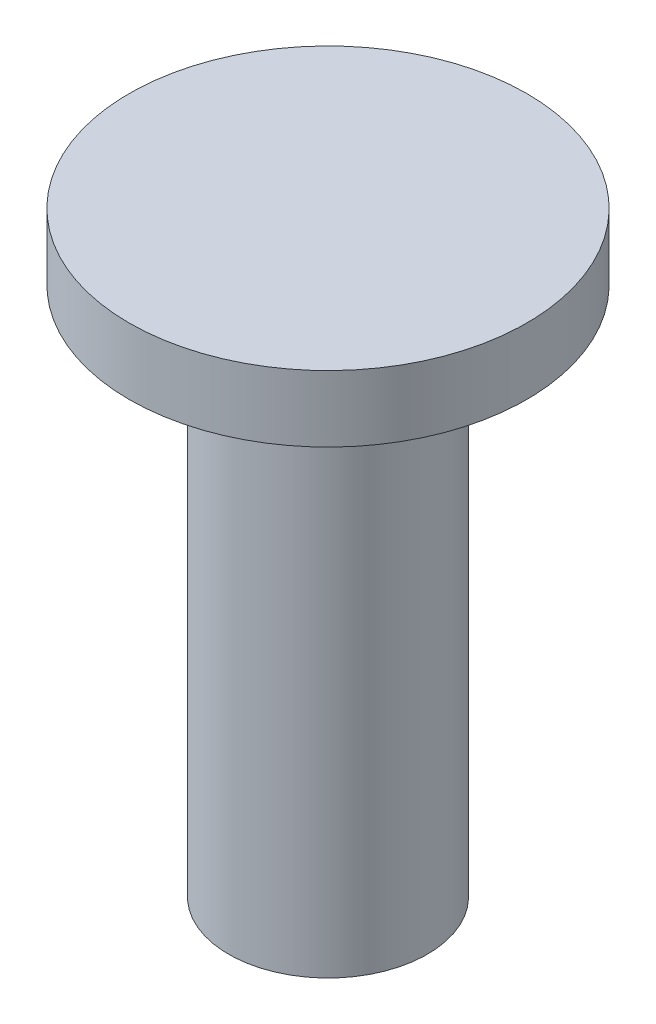
from build123d import *

# Parameters (mm, degrees)
SKETCH_1_R      = 3
EXTRUDE_1_DEPTH = 1
SKETCH_2_R      = 1.5
EXTRUDE_2_DEPTH = 8


with BuildPart() as part:
    # 草图1 → 凸台-拉伸1 (new body)
    with BuildSketch(Plane(origin=(0, 0, 0), x_dir=(1, 0, 0), z_dir=(0, 1, 0))):
        with Locations(Location((0, 0, 0), (0, 0, 270))):
            Circle(SKETCH_1_R)
    extrude(amount=EXTRUDE_1_DEPTH)

    # 草图2 → 凸台-拉伸2 (add)
    with BuildSketch(Plane.XZ):
        with Locations(Location((0, 0, 0), (0, 0, 270))):
            Circle(SKETCH_2_R)
    extrude(amount=EXTRUDE_2_DEPTH)


solid = part.part
